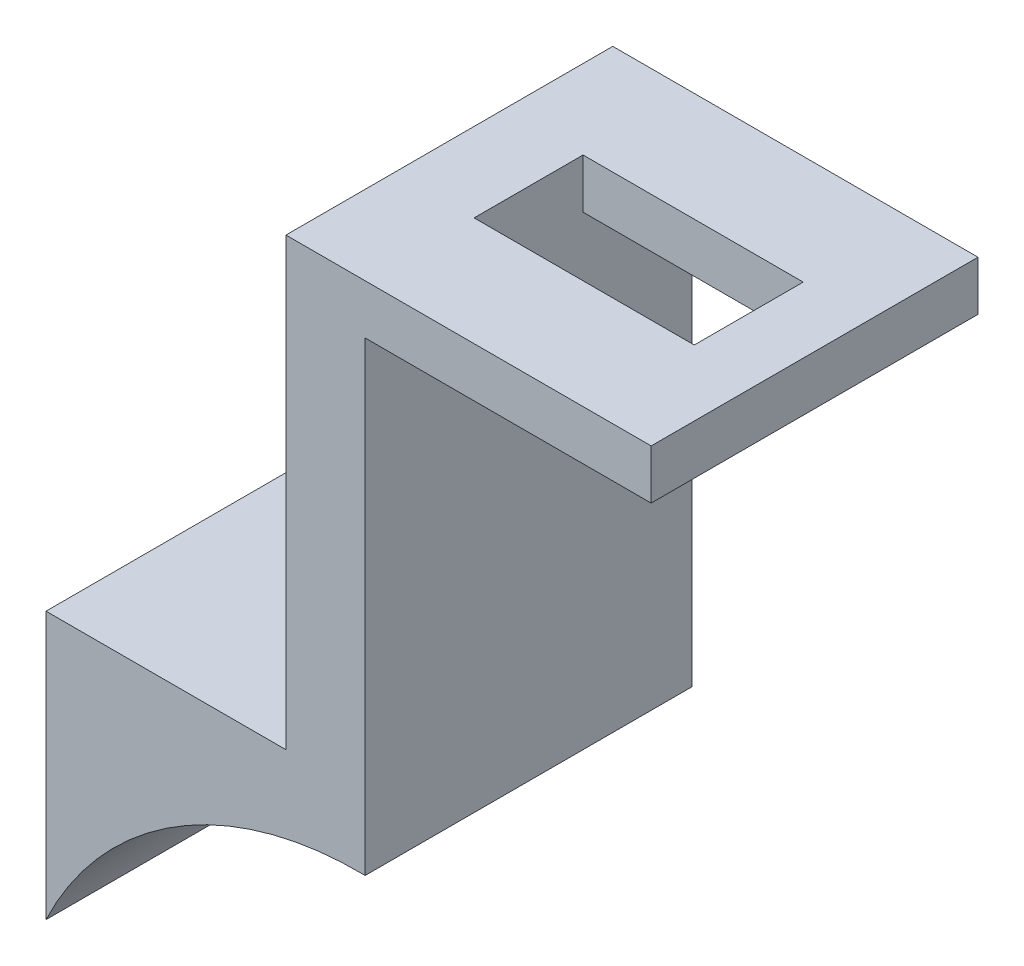
from build123d import *

# Parameters (mm, degrees)
BOSS_EXTRUDE1_DEPTH     = 33
CUT_EXTRUDE1_DEPTH      = 91.853055804
CUT_EXTRUDE1_DEPTH_BACK = 10
SKETCH2_W               = 22.2275
SKETCH2_H               = 11
SKETCH3_R               = 1.5
CUT_EXTRUDE2_DEPTH      = 8


with BuildPart() as part:
    # Sketch1 → Boss-Extrude1 (new body)
    with BuildSketch(Plane.XY):
        with BuildLine():
            Line((-20.326959821, 19.197684275), (16.548040179, 19.197684275))
            Line((16.548040179, 19.197684275), (16.548040179, 14.197684275))
            Line((16.548040179, 14.197684275), (-12.326959821, 14.197684275))
            Line((-12.326959821, 14.197684275), (-12.326959821, -32.802315725))
            ThreePointArc((-12.326959821, -32.802315725), (-31.378402335, -38.048517976), (-44.551959821, -52.777315725))
            Line((-44.551959821, -52.777315725), (-44.551959821, -25.802315725))
            Line((-44.551959821, -25.802315725), (-20.326959821, -25.802315725))
            Line((-20.326959821, -25.802315725), (-20.326959821, 14.197684275))
            Line((-20.326959821, 14.197684275), (-20.326959821, 19.197684275))
        make_face()
    extrude(amount=BOSS_EXTRUDE1_DEPTH)

    # Sketch2 → Cut-Extrude1 (cut, two sides: drawn at the far end of the back side and taken through both)
    with BuildSketch(Plane(origin=(0, 19.197684275, 0), x_dir=(1, 0, 0), z_dir=(0, 1, 0)).offset(-CUT_EXTRUDE1_DEPTH_BACK)):
        with Locations((-1.213209821, -16.5)):
            Rectangle(SKETCH2_W, SKETCH2_H)
    extrude(amount=CUT_EXTRUDE1_DEPTH + CUT_EXTRUDE1_DEPTH_BACK, mode=Mode.SUBTRACT)

    # Sketch3 → Cut-Extrude2 (cut)
    with BuildSketch(Plane.ZY.offset(44.551959821)):
        with Locations((16.5, -40.777315725)):
            Circle(SKETCH3_R)
        with Locations((16.5, -30.777315725)):
            Circle(SKETCH3_R)
    extrude(amount=-CUT_EXTRUDE2_DEPTH, mode=Mode.SUBTRACT)


solid = part.part
